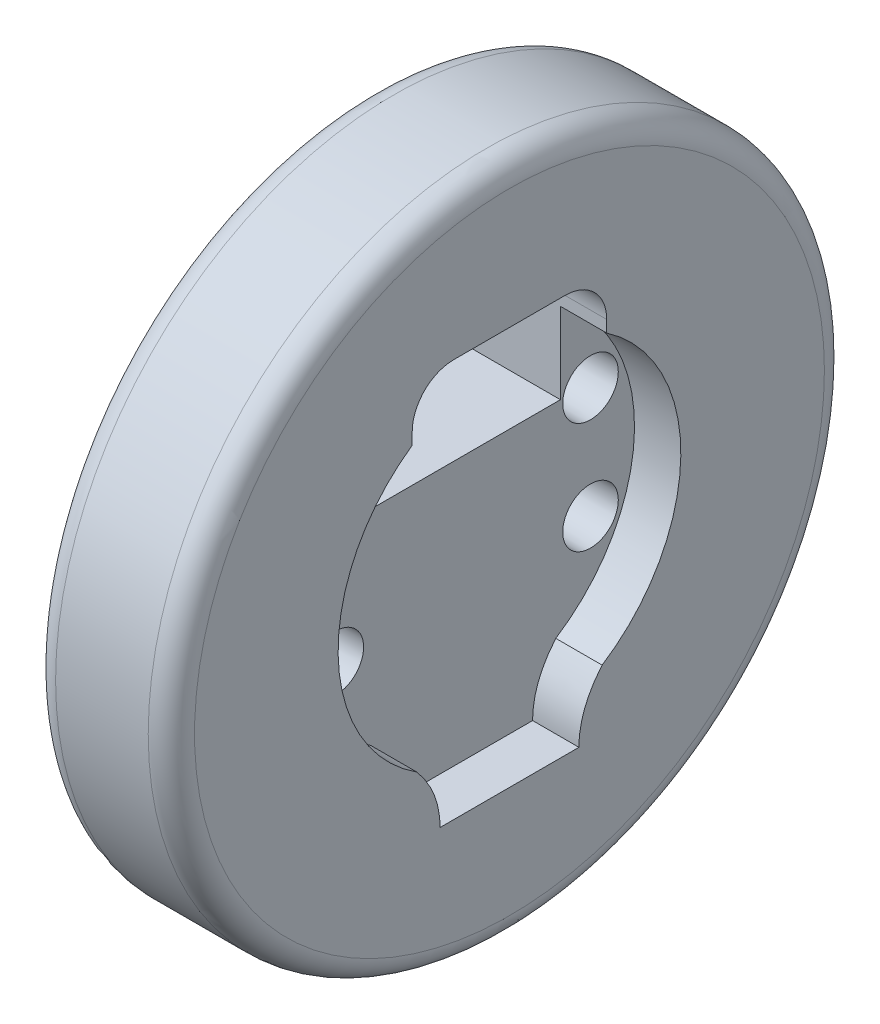
from build123d import *

# Parameters (mm, degrees)
SKETCH2_R                    = 36.5
BOSS_EXTRUDE1_DEPTH          = 15
CUT_EXTRUDE1_DEPTH           = 5
CUT_EXTRUDE2_DEPTH           = 10
CUT_EXTRUDE2_DEPTH_BACK      = 53.57851286
SKETCH4_3_R                  = 3
CUT_EXTRUDE4_DEPTH           = 10
CUT_EXTRUDE4_DRAFT           = -1
CUT_EXTRUDE4_PROFILE_2_DEPTH = 10
CUT_EXTRUDE4_PROFILE_2_DRAFT = -1
CUT_EXTRUDE4_PROFILE_3_DEPTH = 10
CUT_EXTRUDE4_PROFILE_3_DRAFT = -1
CUT_EXTRUDE4_PROFILE_4_DEPTH = 10
CUT_EXTRUDE4_PROFILE_4_DRAFT = -1
EXTRUDE_THIN1_DEPTH          = 4
EXTRUDE_THIN1_DEPTH_BACK     = 10
BOSS_EXTRUDE8_DEPTH          = 4
BOSS_EXTRUDE8_DEPTH_BACK     = 10
CUT_EXTRUDE5_DEPTH           = 6
FILLET1_R                    = 2.5


with BuildPart() as part:
    # Sketch2 → Boss-Extrude1 (new body)
    with BuildSketch(Plane(origin=(0, 0, 0), x_dir=(0, 0, -1), z_dir=(1, 0, 0))):
        Circle(SKETCH2_R)
    extrude(amount=-BOSS_EXTRUDE1_DEPTH)

    # Sketch3 → Cut-Extrude1 (cut)
    with BuildSketch(Plane(origin=(0, 0, 0), x_dir=(0, 0, -1), z_dir=(1, 0, 0))):
        with BuildLine():
            add(Edge.make_bspline(
                [(-10, -15.564382416), (-7.5, -18.5), (-7.5, -22)],
                knots=[0, 0, 0, 1, 1, 1], degree=2))
            Line((-7.5, -22), (7.5, -22))
            add(Edge.make_bspline(
                [(10, -15.564382416), (7.5, -18.5), (7.5, -22)],
                knots=[0, 0, 0, 1, 1, 1], degree=2))
            ThreePointArc((10, -15.564382416), (0, 18.5), (-10, -15.564382416))
        make_face()
    extrude(amount=-CUT_EXTRUDE1_DEPTH, mode=Mode.SUBTRACT)

    # Sketch4 → Cut-Extrude2 (cut, two sides: drawn at the far end of the back side and taken through both)
    with BuildSketch(Plane(origin=(-5, 0, 0), x_dir=(0, 0, -1), z_dir=(1, 0, 0)).offset(-CUT_EXTRUDE2_DEPTH_BACK)):
        with BuildLine():
            ThreePointArc((-6, 21), (-9.181980515, 19.681980515), (-10.5, 16.5))
            Line((-10.5, 16.5), (-10.5, 6.5))
            Line((-10.5, 6.5), (10.5, 6.5))
            Line((10.5, 6.5), (10.5, 16.5))
            ThreePointArc((10.5, 16.5), (9.181980515, 19.681980515), (6, 21))
            Line((6, 21), (-6, 21))
        make_face()
    extrude(amount=CUT_EXTRUDE2_DEPTH + CUT_EXTRUDE2_DEPTH_BACK, mode=Mode.SUBTRACT)


with BuildPart() as cut_extrude4_tool:
    # Sketch4<3> → Cut-Extrude4 (with draft: the straight prism first)
    with BuildSketch(Plane(origin=(-5, 0, 0), x_dir=(0, 0, -1), z_dir=(1, 0, 0))):
        with Locations((13.747727085, 6)):
            Circle(SKETCH4_3_R)
    extrude(amount=-CUT_EXTRUDE4_DEPTH)
    # Cut-Extrude4: the draft: its side faces are tilted about the plane it starts from
    cut_extrude4_sides = [cut_extrude4_tool.faces().sort_by_distance(p)[0] for p in [
        (-10, 6, -10.747727085),
    ]]
    draft(cut_extrude4_sides, Plane(origin=(-5, 0, 0), x_dir=(0, 0, -1), z_dir=(1, 0, 0)), CUT_EXTRUDE4_DRAFT)


with BuildPart() as part_1:
    add(part.part)

    # Cut-Extrude4: cut by cut_extrude4_tool
    add(cut_extrude4_tool.part, mode=Mode.SUBTRACT)


with BuildPart() as cut_extrude4_profile_2_tool:
    # Sketch4<3> → Cut-Extrude4 profile 2 (with draft: the straight prism first)
    with BuildSketch(Plane(origin=(-5, 0, 0), x_dir=(0, 0, -1), z_dir=(1, 0, 0))):
        with Locations((13.747727085, -6)):
            Circle(SKETCH4_3_R)
    extrude(amount=-CUT_EXTRUDE4_PROFILE_2_DEPTH)
    # Cut-Extrude4 profile 2: the draft: its side faces are tilted about the plane it starts from
    cut_extrude4_profile_2_sides = [cut_extrude4_profile_2_tool.faces().sort_by_distance(p)[0] for p in [
        (-10, -6, -10.747727085),
    ]]
    draft(cut_extrude4_profile_2_sides, Plane(origin=(-5, 0, 0), x_dir=(0, 0, -1), z_dir=(1, 0, 0)), CUT_EXTRUDE4_PROFILE_2_DRAFT)


with BuildPart() as part_2:
    add(part_1.part)

    # Cut-Extrude4 profile 2: cut by cut_extrude4_profile_2_tool
    add(cut_extrude4_profile_2_tool.part, mode=Mode.SUBTRACT)


with BuildPart() as cut_extrude4_profile_3_tool:
    # Sketch4<3> → Cut-Extrude4 profile 3 (with draft: the straight prism first)
    with BuildSketch(Plane(origin=(-5, 0, 0), x_dir=(0, 0, -1), z_dir=(1, 0, 0))):
        with Locations((-13.747727085, 6)):
            Circle(SKETCH4_3_R)
    extrude(amount=-CUT_EXTRUDE4_PROFILE_3_DEPTH)
    # Cut-Extrude4 profile 3: the draft: its side faces are tilted about the plane it starts from
    cut_extrude4_profile_3_sides = [cut_extrude4_profile_3_tool.faces().sort_by_distance(p)[0] for p in [
        (-10, 6, 16.747727085),
    ]]
    draft(cut_extrude4_profile_3_sides, Plane(origin=(-5, 0, 0), x_dir=(0, 0, -1), z_dir=(1, 0, 0)), CUT_EXTRUDE4_PROFILE_3_DRAFT)


with BuildPart() as part_3:
    add(part_2.part)

    # Cut-Extrude4 profile 3: cut by cut_extrude4_profile_3_tool
    add(cut_extrude4_profile_3_tool.part, mode=Mode.SUBTRACT)


with BuildPart() as cut_extrude4_profile_4_tool:
    # Sketch4<3> → Cut-Extrude4 profile 4 (with draft: the straight prism first)
    with BuildSketch(Plane(origin=(-5, 0, 0), x_dir=(0, 0, -1), z_dir=(1, 0, 0))):
        with Locations((-13.747727085, -6)):
            Circle(SKETCH4_3_R)
    extrude(amount=-CUT_EXTRUDE4_PROFILE_4_DEPTH)
    # Cut-Extrude4 profile 4: the draft: its side faces are tilted about the plane it starts from
    cut_extrude4_profile_4_sides = [cut_extrude4_profile_4_tool.faces().sort_by_distance(p)[0] for p in [
        (-10, -6, 16.747727085),
    ]]
    draft(cut_extrude4_profile_4_sides, Plane(origin=(-5, 0, 0), x_dir=(0, 0, -1), z_dir=(1, 0, 0)), CUT_EXTRUDE4_PROFILE_4_DRAFT)


with BuildPart() as part_4:
    add(part_3.part)

    # Cut-Extrude4 profile 4: cut by cut_extrude4_profile_4_tool
    add(cut_extrude4_profile_4_tool.part, mode=Mode.SUBTRACT)

    # Sketch10 → Cut-Extrude5 (cut)
    with BuildSketch(Plane.ZY.offset(15)):
        with BuildLine():
            Line((1.3, -1), (1.3, 0))
            ThreePointArc((1.3, 0), (0, 1.3), (-1.3, 0))
            Line((-1.3, 0), (-1.3, -1))
            Line((-1.3, -1), (1.3, -1))
        make_face()
    extrude(amount=-CUT_EXTRUDE5_DEPTH, mode=Mode.SUBTRACT)

    # Fillet1
    fillet1_edges = [part_4.edges().sort_by_distance(p)[0] for p in [
        (0, 0, 36.5),
        (-15, 0, 36.5),
    ]]
    fillet(fillet1_edges, radius=FILLET1_R)


with BuildPart() as body_2:
    # Sketch5 → Extrude-Thin1 (new, two sides: drawn at the far end of the back side and taken through both)
    with BuildSketch(Plane.ZY.offset(15).offset(-EXTRUDE_THIN1_DEPTH_BACK)):
        with BuildLine():
            Line((-3.3, 0), (-3.3, -3))
            Line((-3.3, -3), (3.3, -3))
            Line((3.3, -3), (3.3, 0))
            ThreePointArc((3.3, 0), (0, 3.3), (-3.3, 0))
        make_face()
        with BuildLine():
            Line((-1.3, 0), (-1.3, -1))
            Line((-1.3, -1), (1.3, -1))
            Line((1.3, -1), (1.3, 0))
            ThreePointArc((1.3, 0), (0, 1.3), (-1.3, 0))
        make_face(mode=Mode.SUBTRACT)
    extrude(amount=EXTRUDE_THIN1_DEPTH + EXTRUDE_THIN1_DEPTH_BACK)


with BuildPart() as body_3:
    # Sketch5<4> → Boss-Extrude8 (new, two sides: drawn at the far end of the back side and taken through both)
    with BuildSketch(Plane.ZY.offset(15).offset(-BOSS_EXTRUDE8_DEPTH_BACK)):
        Polygon((-1.3, -1), (-1.3, 0), (-1.3, 1), (-5, 1), (-5, -1.3), (-1, -1.3), (0, -1.3), (0, -1), align=None)
        with BuildLine():
            Line((-1.3, 1), (-1.3, 0))
            ThreePointArc((-1.3, 0), (-0.919238816, 0.919238816), (0, 1.3))
            Line((0, 1.3), (1, 1.3))
            Line((1, 1.3), (1, 5))
            Line((1, 5), (-1.3, 5))
            Line((-1.3, 5), (-1.3, 1))
        make_face()
        with BuildLine():
            Line((1, 1.3), (0, 1.3))
            ThreePointArc((0, 1.3), (0.919238816, 0.919238816), (1.3, 0))
            Line((1.3, 0), (1.3, -1))
            Line((1.3, -1), (5, -1))
            Line((5, -1), (5, 1.3))
            Line((5, 1.3), (1, 1.3))
        make_face()
        Polygon((1.3, -1.3), (0, -1.3), (-1, -1.3), (-1, -5), (1.3, -5), align=None)
    extrude(amount=BOSS_EXTRUDE8_DEPTH + BOSS_EXTRUDE8_DEPTH_BACK)


solid = Compound([part_4.part, body_2.part, body_3.part])
